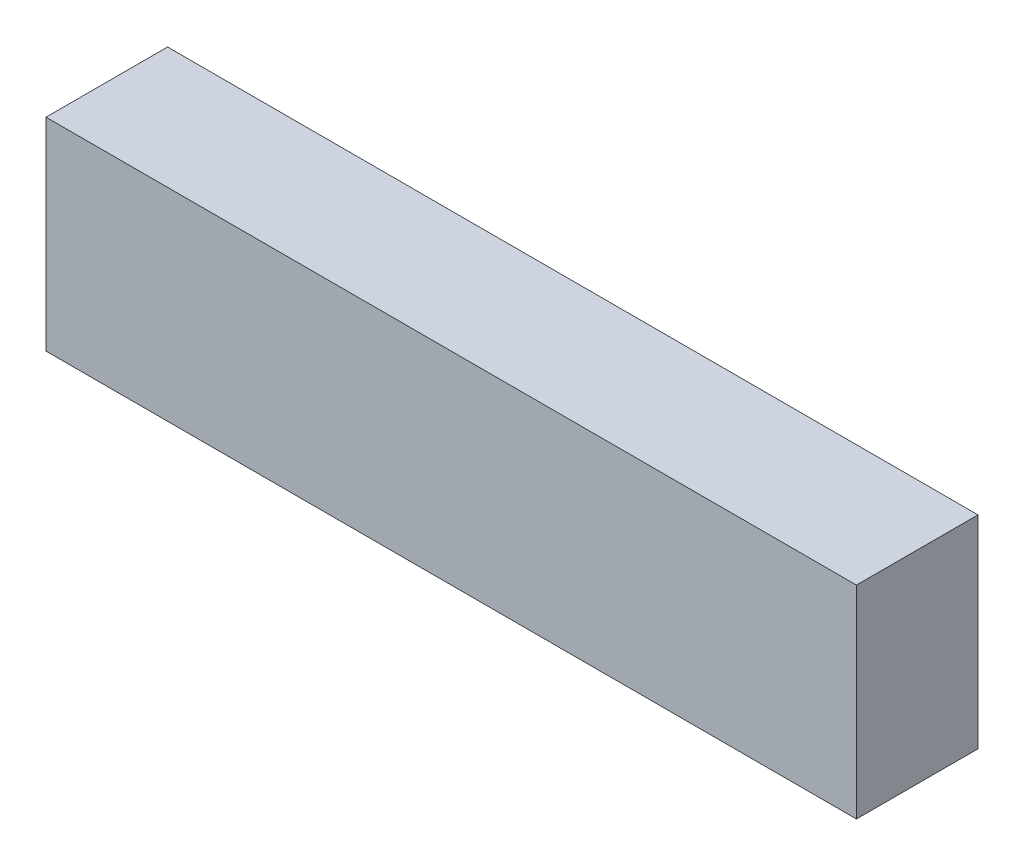
from build123d import *

# Parameters (mm, degrees)
SKETCH_1_W      = 200
SKETCH_1_H      = 50
EXTRUDE_1_DEPTH = 30


with BuildPart() as part:
    # Эскиз1 → Бобышка-Вытянуть1 (new body)
    with BuildSketch(Plane.XY):
        Rectangle(SKETCH_1_W, SKETCH_1_H)
    extrude(amount=EXTRUDE_1_DEPTH)


solid = part.part
